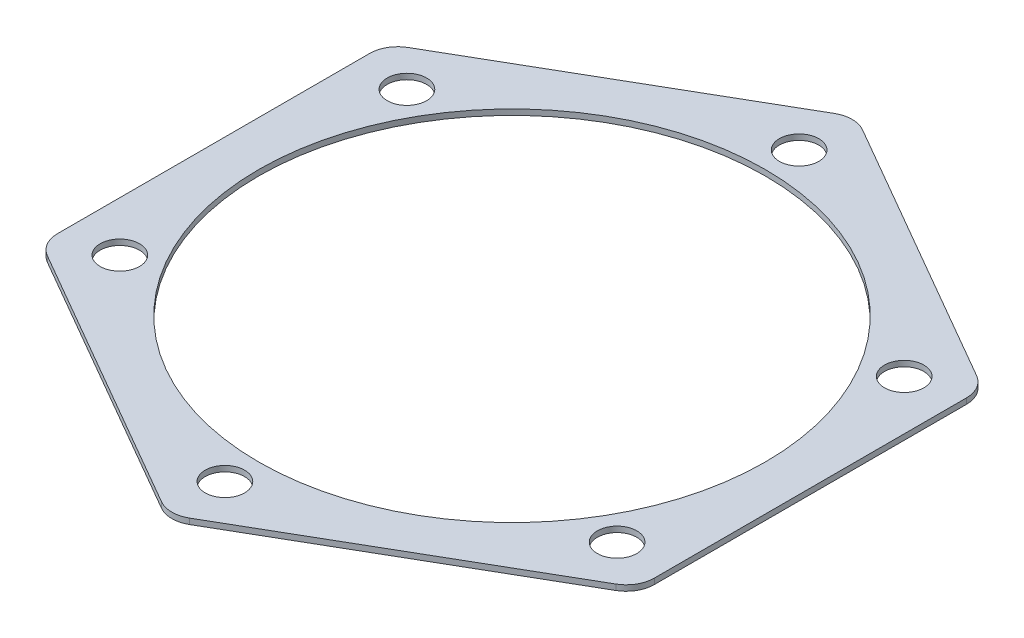
from build123d import *

# Parameters (mm, degrees)
SKETCH1_R           = 45
SKETCH1_R_2         = 3.5
BOSS_EXTRUDE1_DEPTH = 1


with BuildPart() as part:
    # Sketch1 → Boss-Extrude1 (new body)
    with BuildSketch(Plane(origin=(0, 0, 0), x_dir=(1, 0, 0), z_dir=(0, 1, 0))):
        with BuildLine():
            Line((-50.5, -32.04293994), (-2.5, -59.755752861))
            ThreePointArc((-2.5, -59.755752861), (0, -60.425625842), (2.5, -59.755752861))
            Line((2.5, -59.755752861), (50.5, -32.04293994))
            ThreePointArc((50.5, -32.04293994), (52.330127019, -30.212812921), (53, -27.712812921))
            Line((53, -27.712812921), (53, 27.712812921))
            ThreePointArc((53, 27.712812921), (52.330127019, 30.212812921), (50.5, 32.04293994))
            Line((50.5, 32.04293994), (2.5, 59.755752861))
            ThreePointArc((2.5, 59.755752861), (0, 60.425625842), (-2.5, 59.755752861))
            Line((-2.5, 59.755752861), (-50.5, 32.04293994))
            ThreePointArc((-50.5, 32.04293994), (-52.330127019, 30.212812921), (-53, 27.712812921))
            Line((-53, 27.712812921), (-53, -27.712812921))
            ThreePointArc((-53, -27.712812921), (-52.330127019, -30.212812921), (-50.5, -32.04293994))
        make_face()
        with Locations(Location((0, 0, 0), (0, 0, 270))):
            Circle(SKETCH1_R, mode=Mode.SUBTRACT)
        with Locations(Location((0, 51, 0), (0, 0, 270))):
            Circle(SKETCH1_R_2, mode=Mode.SUBTRACT)
        with Locations(Location((44.167295593, 25.5, 0), (0, 0, 270))):
            Circle(SKETCH1_R_2, mode=Mode.SUBTRACT)
        with Locations(Location((44.167295593, -25.5, 0), (0, 0, 270))):
            Circle(SKETCH1_R_2, mode=Mode.SUBTRACT)
        with Locations(Location((0, -51, 0), (0, 0, 270))):
            Circle(SKETCH1_R_2, mode=Mode.SUBTRACT)
        with Locations(Location((-44.167295593, -25.5, 0), (0, 0, 270))):
            Circle(SKETCH1_R_2, mode=Mode.SUBTRACT)
        with Locations(Location((-44.167295593, 25.5, 0), (0, 0, 270))):
            Circle(SKETCH1_R_2, mode=Mode.SUBTRACT)
    extrude(amount=BOSS_EXTRUDE1_DEPTH)


solid = part.part
